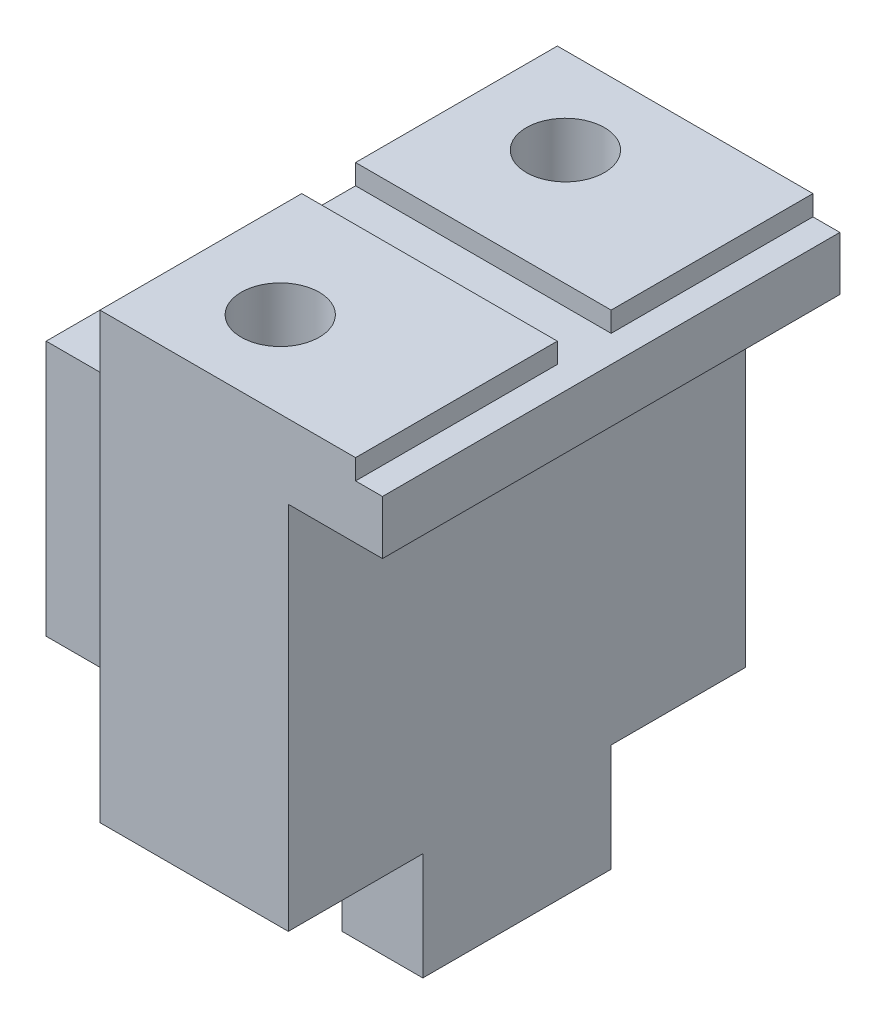
from build123d import *

# Parameters (mm, degrees)
SALIENTE_EXTRUIR1_DEPTH      = 7
CROQUIS5_R                   = 1.6
CORTAR_EXTRUIR2_DEPTH        = 13.9
CROQUIS6_R                   = 2.75
CORTAR_EXTRUIR3_DEPTH        = 3
SALIENTE_EXTRUIR2_DEPTH      = 5
SALIENTE_EXTRUIR2_DEPTH_BACK = 12
CROQUIS8_R                   = 1.45
CORTAR_EXTRUIR4_DEPTH        = 10
CROQUIS9_W                   = 2
CROQUIS9_H                   = 0.75
CORTAR_EXTRUIR5_DEPTH        = 10


with BuildPart() as part:
    # Croquis1 → Saliente-Extruir1 (new body)
    with BuildSketch(Plane.XY):
        Polygon((0, 0), (4, 0), (4, -4), (7, -4), (7, 0), (7, 13.75), (10.5, 13.75), (10.5, 15.75), (9.5, 15.75), (9.5, 16.5), (7, 16.5), (0, 16.5), (0, 9.5), (-7, 9.5), (-7, 0), align=None)
    extrude(amount=SALIENTE_EXTRUIR1_DEPTH)

    # Croquis5 → Cortar-Extruir2 (cut)
    with BuildSketch(Plane(origin=(0, 9.5, 0), x_dir=(1, 0, 0), z_dir=(0, 1, 0))):
        with Locations(Location((-3.5, -3.5, 0), (0, 0, 180))):
            Circle(CROQUIS5_R)
    extrude(amount=-CORTAR_EXTRUIR2_DEPTH, mode=Mode.SUBTRACT)

    # Croquis6 → Cortar-Extruir3 (cut)
    with BuildSketch(Plane(origin=(0, 9.5, 0), x_dir=(1, 0, 0), z_dir=(0, 1, 0))):
        with Locations(Location((-3.5, -3.5, 0), (0, 0, 180))):
            Circle(CROQUIS6_R)
    extrude(amount=-CORTAR_EXTRUIR3_DEPTH, mode=Mode.SUBTRACT)

    # Croquis7 → Saliente-Extruir2 (add, two sides: drawn at the far end of the back side and taken through both)
    with BuildSketch(Plane.XY.offset(7).offset(-SALIENTE_EXTRUIR2_DEPTH_BACK)):
        Polygon((0, 16.5), (0, 0), (7, 0), (7, 13.75), (10.5, 13.75), (10.5, 15.75), (9.5, 15.75), (9.5, 16.5), align=None)
    extrude(amount=SALIENTE_EXTRUIR2_DEPTH + SALIENTE_EXTRUIR2_DEPTH_BACK)

    # Croquis8 → Cortar-Extruir4 (cut)
    with BuildSketch(Plane(origin=(0, 16.5, 0), x_dir=(1, 0, 0), z_dir=(0, 1, 0))):
        with Locations(Location((3.5, 1.8, 0), (0, 0, 270))):
            Circle(CROQUIS8_R)
        with Locations(Location((3.5, -8.8, 0), (0, 0, 90))):
            Circle(CROQUIS8_R)
    extrude(amount=-CORTAR_EXTRUIR4_DEPTH, mode=Mode.SUBTRACT)

    # Croquis9 → Cortar-Extruir5 (cut)
    with BuildSketch(Plane(origin=(9.5, 0, 0), x_dir=(0, 0, -1), z_dir=(1, 0, 0))):
        with Locations((-3.5, 16.125)):
            Rectangle(CROQUIS9_W, CROQUIS9_H)
    extrude(amount=-CORTAR_EXTRUIR5_DEPTH, mode=Mode.SUBTRACT)


solid = part.part
